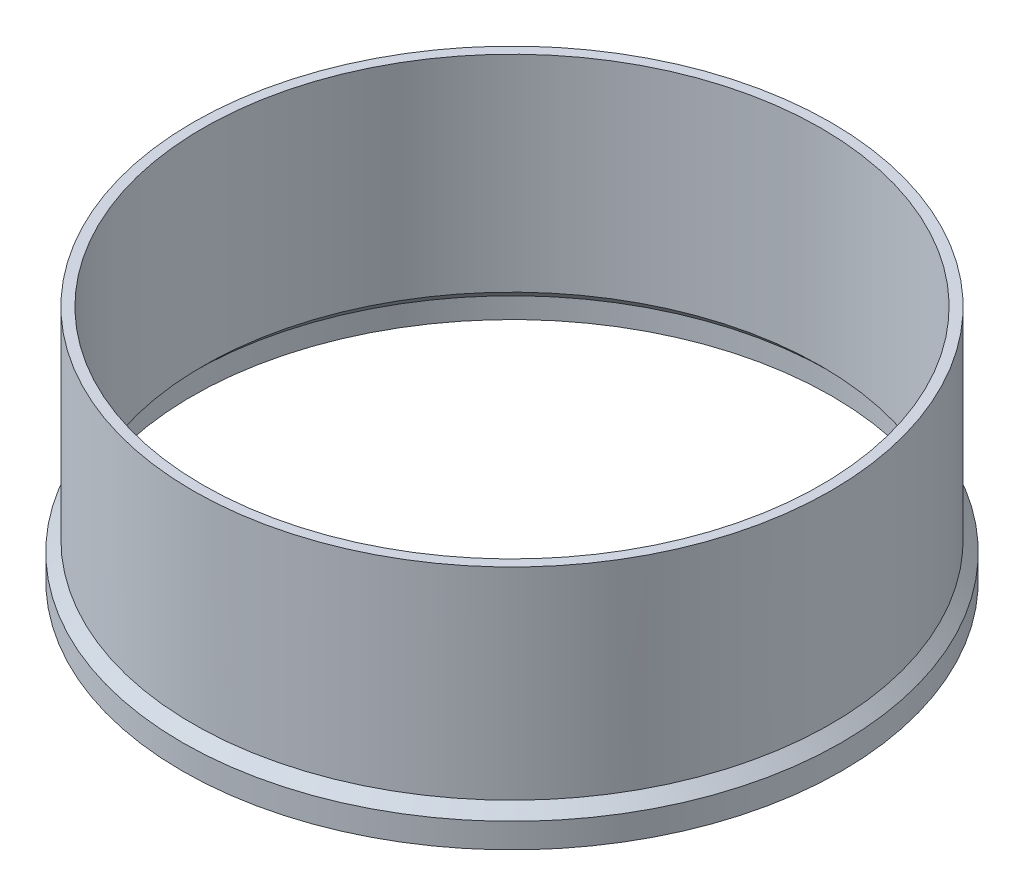
from build123d import *

# Parameters (mm, degrees)
SKETCH1_R           = 77.4
SKETCH1_R_2         = 75
BOSS_EXTRUDE1_DEPTH = 50


with BuildPart() as part:
    # Sketch1 → Boss-Extrude1 (new body)
    with BuildSketch(Plane(origin=(0, 0, 0), x_dir=(1, 0, 0), z_dir=(0, 1, 0))):
        with Locations(Location((0, 0, 0), (0, 0, 270))):
            Circle(SKETCH1_R)
        with Locations(Location((0, 0, 0), (0, 0, 270))):
            Circle(SKETCH1_R_2, mode=Mode.SUBTRACT)
    extrude(amount=BOSS_EXTRUDE1_DEPTH)

    # Sketch4 → Revolve1 (revolve)
    with BuildSketch(Plane.XY, mode=Mode.PRIVATE) as revolve1_sk:
        Polygon((75, 0), (77.6, -2.6), (77.6, -7.6), (80, -7.6), (80, -1.60588745), (77.4, 0.99411255), (77.4, 0), align=None)
    revolve(revolve1_sk.sketch.rotate(Axis((0, 0, 0), (0, 1, 0)), 90), axis=Axis((0, 0, 0), (0, 1, 0)))


solid = part.part
